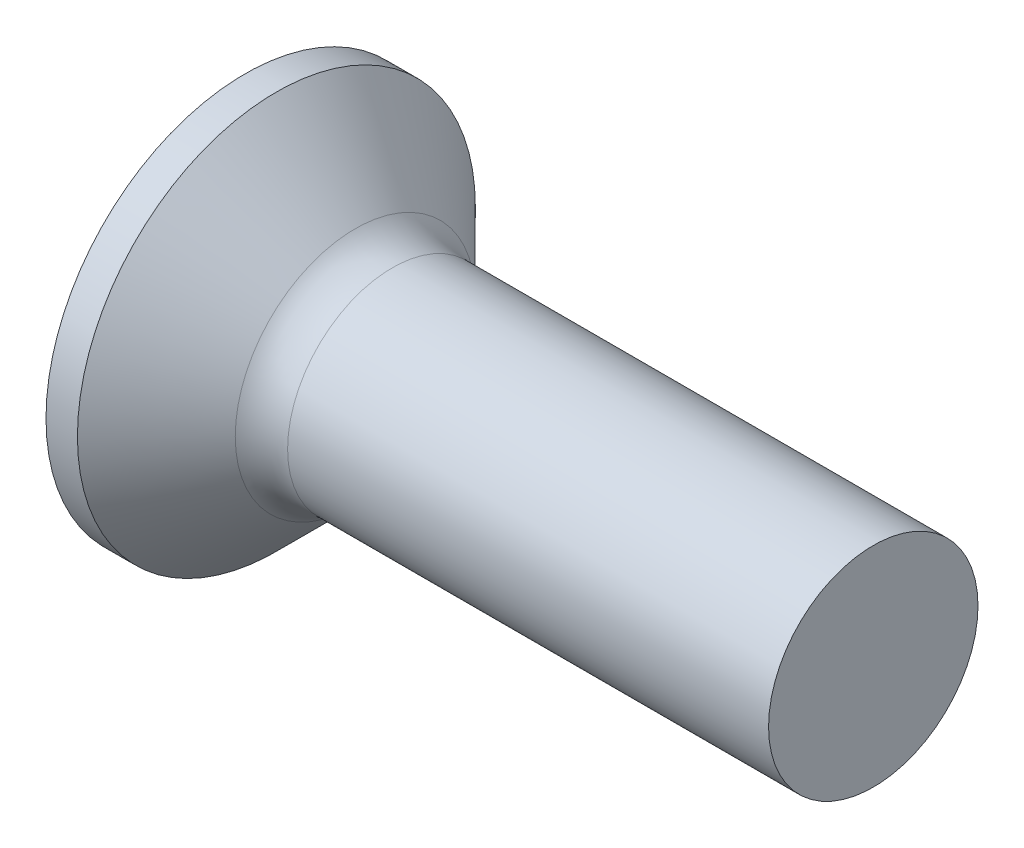
from build123d import *

# Parameters (mm, degrees)
FILLET1_R    = 0.5
RECPAT_COUNT = 2
RECPAT_ANGLE = 90


with BuildPart() as part:
    # BodySke → Base-Revolve (revolve)
    with BuildSketch(Plane.XY, mode=Mode.PRIVATE) as base_revolve_sk:
        Polygon((0, 0), (0, 1.9), (0.3, 1.9), (1.2, 1), (6, 1), (6, 0), align=None)
    revolve(base_revolve_sk.sketch.rotate(Axis((-6.35, 0, 0), (1, 0, 0)), 90), axis=Axis((-6.35, 0, 0), (1, 0, 0)))

    # Fillet1
    fillet1_edges = [part.edges().sort_by_distance(p)[0] for p in [
        (1.2, 0, -1),
    ]]
    fillet(fillet1_edges, radius=FILLET1_R)

    # Sketch3 → Recess section 0
    with BuildSketch(Plane.ZY):
        with BuildLine():
            Line((-0.24, 0.95), (0.24, 0.95))
            Line((0.24, 0.95), (0.24, -0.95))
            Line((0.24, -0.95), (-0.24, -0.95))
            Line((-0.24, -0.95), (-0.24, 0.95))
        make_face()
    # Sketch4 → Recess section 1
    with BuildSketch(Plane.ZY.offset(-1.2)):
        with BuildLine():
            Line((-0.24, 0.351702091), (0.24, 0.351702091))
            Line((0.24, 0.351702091), (0.24, -0.351702091))
            Line((0.24, -0.351702091), (-0.24, -0.351702091))
            Line((-0.24, -0.351702091), (-0.24, 0.351702091))
        make_face()
    recess = loft(mode=Mode.SUBTRACT)

    # RecPat: Recess ×2 about axis
    recpat_axis = Axis((0, 0, 0), (1, 0, 0))
    for i in range(1, RECPAT_COUNT):
        add(recess.rotate(recpat_axis, i * RECPAT_ANGLE / (RECPAT_COUNT - 1)), mode=Mode.SUBTRACT)

    # RecCorSke → RecessCore (revolve, cut)
    with BuildSketch(Plane.XY, mode=Mode.PRIVATE) as recesscore_sk:
        Polygon((0, 0), (0, 0.439412174), (1.2, 0.3555), (1.315508952, 0), align=None)
    revolve(recesscore_sk.sketch.rotate(Axis((-3.175, 0, 0), (1, 0, 0)), 90), axis=Axis((-3.175, 0, 0), (1, 0, 0)), mode=Mode.SUBTRACT)


solid = part.part
